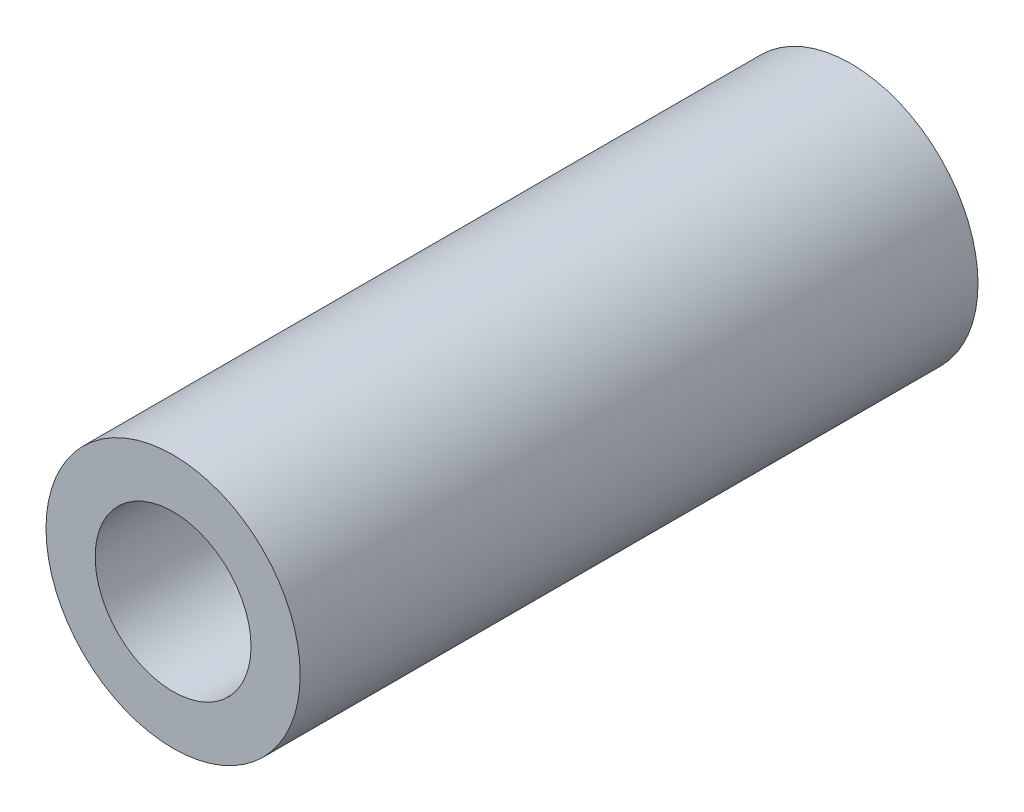
from build123d import *

# Parameters (mm, degrees)
SKETCH1_R      = 2.38125
SKETCH1_R_2    = 1.4605
EXTRUDE1_DEPTH = 6.35


with BuildPart() as part:
    # Sketch1 → Extrude1 (new, symmetric)
    with BuildSketch(Plane.XY):
        Circle(SKETCH1_R)
        Circle(SKETCH1_R_2, mode=Mode.SUBTRACT)
    extrude(amount=EXTRUDE1_DEPTH, both=True)


solid = part.part
